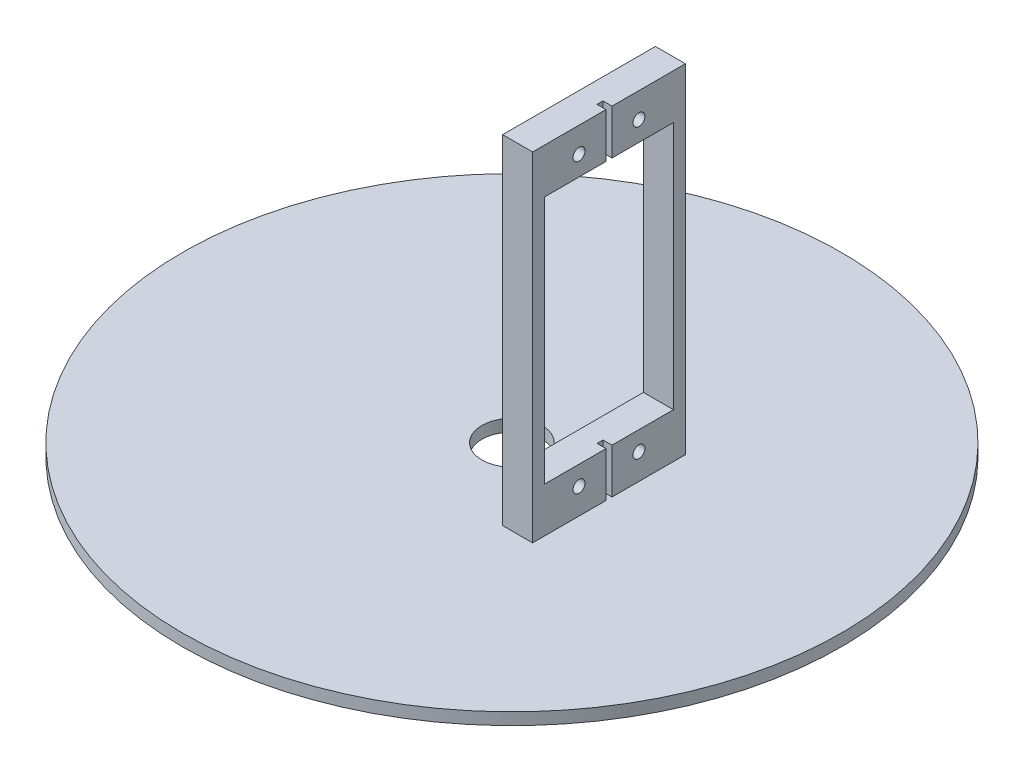
from build123d import *

# Parameters (mm, degrees)
SKETCH1_R           = 55
BOSS_EXTRUDE1_DEPTH = 2
SKETCH2_R           = 5
CUT_EXTRUDE1_DEPTH  = 78.807454656
SKETCH4_W           = 25.5
SKETCH4_H           = 56.5
SKETCH4_W_2         = 21.5
SKETCH4_H_2         = 41.5
BOSS_EXTRUDE2_DEPTH = 5
SKETCH5_R           = 1
CUT_EXTRUDE2_DEPTH  = 108.31584226
SKETCH6_W           = 1
SKETCH6_H           = 56.5
CUT_EXTRUDE3_DEPTH  = 1.5


with BuildPart() as part:
    # Sketch1 → Boss-Extrude1 (new body)
    with BuildSketch(Plane(origin=(0, 0, 0), x_dir=(1, 0, 0), z_dir=(0, 1, 0))):
        with Locations(Location((0, 0, 0), (0, 0, 270))):
            Circle(SKETCH1_R)
    extrude(amount=BOSS_EXTRUDE1_DEPTH)

    # Sketch2 → Cut-Extrude1 (cut, through all)
    with BuildSketch(Plane(origin=(0, 2, 0), x_dir=(1, 0, 0), z_dir=(0, 1, 0))):
        with Locations(Location((0, 0, 0), (0, 0, 270))):
            Circle(SKETCH2_R)
    extrude(amount=-CUT_EXTRUDE1_DEPTH, mode=Mode.SUBTRACT)

    # Sketch4 → Boss-Extrude2 (add)
    with BuildSketch(Plane(origin=(16.2, 0, 0), x_dir=(0, 0, -1), z_dir=(1, 0, 0))):
        with Locations((0, 30.25)):
            Rectangle(SKETCH4_W, SKETCH4_H)
        with Locations((0, 30.25)):
            Rectangle(SKETCH4_W_2, SKETCH4_H_2, mode=Mode.SUBTRACT)
    extrude(amount=-BOSS_EXTRUDE2_DEPTH)

    # Sketch5 → Cut-Extrude2 (cut, through all)
    with BuildSketch(Plane(origin=(16.2, 0, 0), x_dir=(0, 0, -1), z_dir=(1, 0, 0))):
        with Locations((-5, 54.3)):
            Circle(SKETCH5_R)
        with Locations((-5, 6.3)):
            Circle(SKETCH5_R)
        with Locations(Location((5, 6.3, 0), (0, 0, 180))):
            Circle(SKETCH5_R)
        with Locations(Location((5, 54.3, 0), (0, 0, 180))):
            Circle(SKETCH5_R)
    extrude(amount=-CUT_EXTRUDE2_DEPTH, mode=Mode.SUBTRACT)

    # Sketch6 → Cut-Extrude3 (cut)
    with BuildSketch(Plane(origin=(16.2, 0, 0), x_dir=(0, 0, -1), z_dir=(1, 0, 0))):
        with Locations((0, 30.25)):
            Rectangle(SKETCH6_W, SKETCH6_H)
    extrude(amount=-CUT_EXTRUDE3_DEPTH, mode=Mode.SUBTRACT)


solid = part.part
